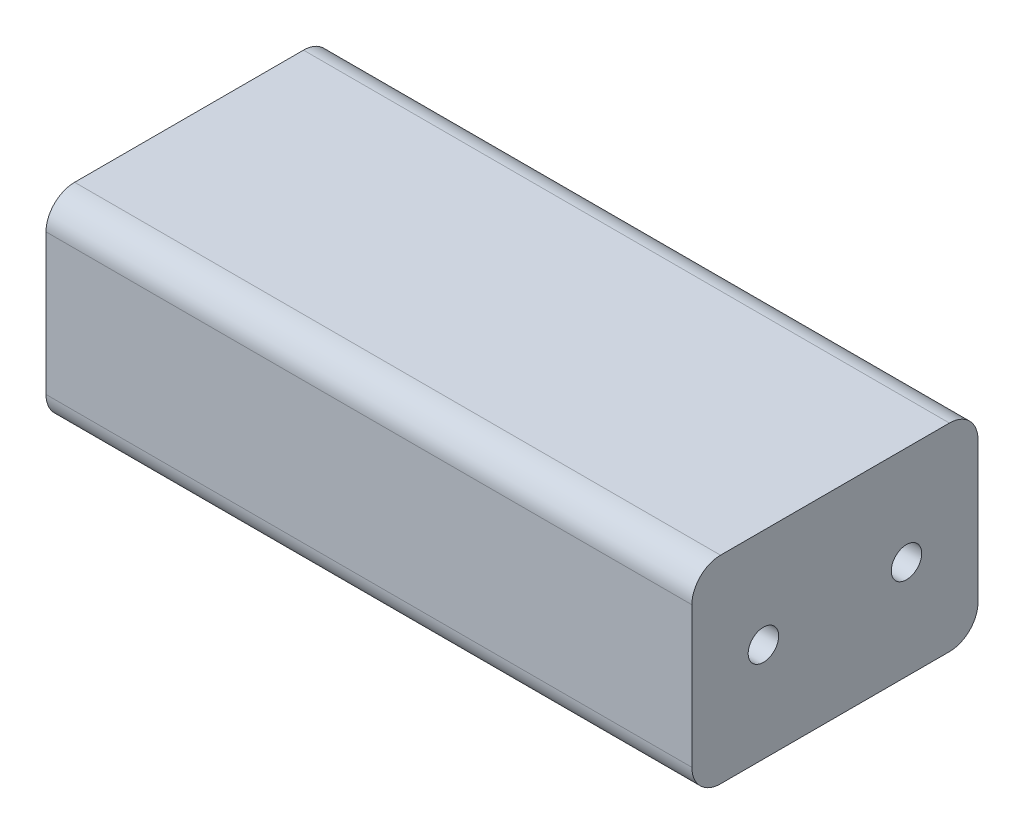
from build123d import *

# Parameters (mm, degrees)
SKETCH1_W                      = 25.4
SKETCH1_H                      = 17.582007
BOSS_EXTRUDE1_DEPTH            = 28.67025
F_6_32_TAPPED_HOLE1_AT_2_COUNT = 2
F_6_32_TAPPED_HOLE1_AT_2_PITCH = 12.7
FILLET1_R                      = 2.54


with BuildPart() as part:
    # Sketch1 → Boss-Extrude1 (new, symmetric)
    with BuildSketch(Plane(origin=(0, 0, 0), x_dir=(0, 0, -1), z_dir=(1, 0, 0))):
        Rectangle(SKETCH1_W, SKETCH1_H)
    extrude(amount=BOSS_EXTRUDE1_DEPTH, both=True)

    # Sketch3 → #6-32 Tapped Hole1 (revolve, cut)
    with BuildSketch(Plane(origin=(28.67025, 0, 6.35), x_dir=(0, 0, -1), z_dir=(0, 1, 0))):
        Polygon((0, 0), (0, 10.21069403), (1.35255, 9.398), (1.35255, 0), align=None)
    f_6_32_tapped_hole1 = revolve(axis=Axis((35.02025, 0, 6.35), (-1, 0, 0)), mode=Mode.SUBTRACT)

    # #6-32 Tapped Hole1 at 2: #6-32 Tapped Hole1 ×2
    with Locations(*[(0, 0, -i * F_6_32_TAPPED_HOLE1_AT_2_PITCH) for i in range(1, F_6_32_TAPPED_HOLE1_AT_2_COUNT)]):
        add(f_6_32_tapped_hole1, mode=Mode.SUBTRACT)

    # Mirror1: #6-32 Tapped Hole1 across plane
    add(f_6_32_tapped_hole1.mirror(Plane(origin=(0, 0, 0), x_dir=(0, 0, 1), z_dir=(1, 0, 0))), mode=Mode.SUBTRACT)

    # Mirror1 copy 1 sketch → Mirror1 copy 1 (revolve, cut)
    with BuildSketch(Plane(origin=(-28.67025, 0, -6.35), x_dir=(0, 0, -1), z_dir=(0, 1, 0))):
        Polygon((0, 0), (0, -10.21069403), (1.35255, -9.398), (1.35255, 0), align=None)
    revolve(axis=Axis((-35.02025, 0, -6.35), (-1, 0, 0)), mode=Mode.SUBTRACT)

    # Fillet1
    fillet1_edges = [part.edges().sort_by_distance(p)[0] for p in [
        (0, -8.7910035, -12.7),
        (0, -8.7910035, 12.7),
        (0, 8.7910035, 12.7),
        (0, 8.7910035, -12.7),
    ]]
    fillet(fillet1_edges, radius=FILLET1_R)


solid = part.part
